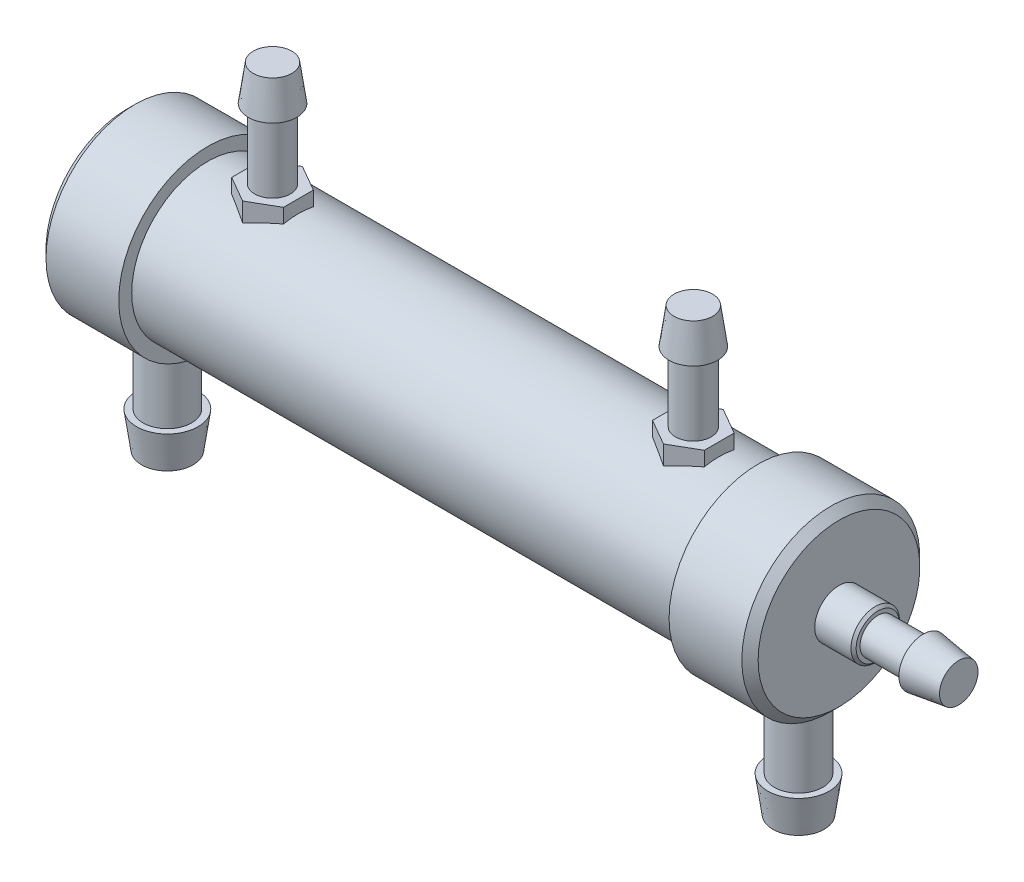
from build123d import *

# Parameters (mm, degrees)
BOSS_EXTRUDE1_DEPTH = 17.4625
CHAMFER1_SIZE       = 1.6002
CHAMFER2_SIZE       = 0.508


with BuildPart() as part:
    # Sketch1 → Revolve1 (revolve)
    with BuildSketch(Plane.XY, mode=Mode.PRIVATE) as revolve1_sk:
        Polygon((0, 0), (0, 17.4625), (15.875, 17.4625), (15.875, 14.9225), (123.825, 14.9225), (123.825, 17.4625), (139.7, 17.4625), (139.7, 4.7625), (147.32, 4.7625), (147.32, 3.4925), (156.21, 3.4925), (156.21, 4.7625), (163.195, 3.78082227), (163.195, 0), align=None)
    revolve(revolve1_sk.sketch.rotate(Axis((0, 0, 0), (1, 0, 0)), 90), axis=Axis((0, 0, 0), (1, 0, 0)))



with BuildPart() as body_2:
    # Sketch2 → Revolve2 (revolve)
    with BuildSketch(Plane.XY, mode=Mode.PRIVATE) as revolve2_sk:
        Polygon((12.7, -17.4625), (12.7, -31.115), (13.97, -31.115), (12.98832227, -38.1), (7.9375, -38.1), (7.9375, -17.4625), align=None)
    revolve(revolve2_sk.sketch.rotate(Axis((7.9375, -0.261290097, 0), (0, -1, 0)), 180), axis=Axis((7.9375, -0.261290097, 0), (0, -1, 0)))


with BuildPart() as body_3:
    # Sketch3 → Revolve3 (revolve)
    with BuildSketch(Plane.XY, mode=Mode.PRIVATE) as revolve3_sk:
        Polygon((25.0825, 14.9225), (25.0825, 31.115), (23.8125, 31.115), (24.79417773, 38.1), (28.575, 38.1), (28.575, 14.9225), align=None)
    revolve(revolve3_sk.sketch.rotate(Axis((28.575, -0.825209821, 0), (0, 1, 0)), 270), axis=Axis((28.575, -0.825209821, 0), (0, 1, 0)))


with BuildPart() as body_4:
    # Mirror4: mirrored copy
    add(body_2.part.mirror(Plane.ZY.offset(-69.85)))


with BuildPart() as body_5:
    # Mirror4 2: mirrored copy
    add(body_3.part.mirror(Plane.ZY.offset(-69.85)))


with BuildPart() as part_1:
    add(part.part)

    add(body_3.part)  # Boss-Extrude1 merges body 3
    # Sketch4 → Boss-Extrude1 (add)
    with BuildSketch(Plane(origin=(0, 0, 0), x_dir=(1, 0, 0), z_dir=(0, 1, 0))):
        Polygon((33.655, -2.932939367), (33.655, 2.932939367), (28.575, 5.865878735), (23.495, 2.932939367), (23.495, -2.932939367), (28.575, -5.865878735), align=None)
        Polygon((111.125, -5.865878735), (116.205, -2.932939367), (116.205, 2.932939367), (111.125, 5.865878735), (106.045, 2.932939367), (106.045, -2.932939367), align=None)
    extrude(amount=BOSS_EXTRUDE1_DEPTH)

    # Chamfer1
    chamfer1_edges = [part_1.edges().sort_by_distance(p)[0] for p in [
        (139.7, 0, -17.4625),
        (0, 0, -17.4625),
    ]]
    chamfer(chamfer1_edges, length=CHAMFER1_SIZE)

    # Chamfer2
    chamfer2_edges = [part_1.edges().sort_by_distance(p)[0] for p in [
        (147.32, 0, -4.7625),
    ]]
    chamfer(chamfer2_edges, length=CHAMFER2_SIZE)


solid = Compound([body_2.part, body_4.part, body_5.part, part_1.part])
